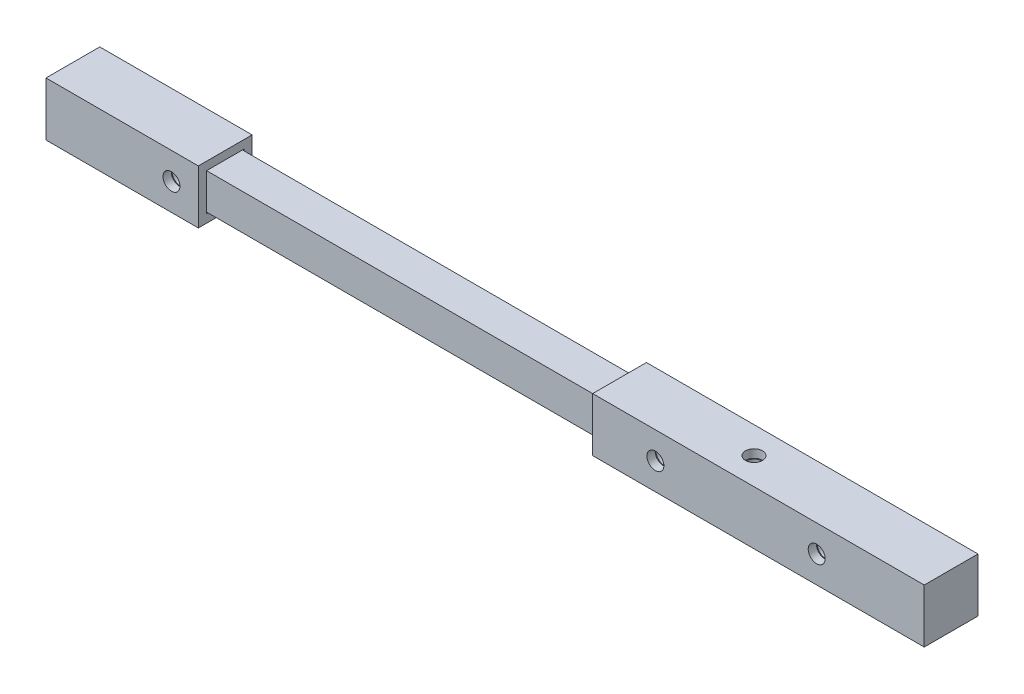
from build123d import *

# Parameters (mm, degrees)
SKETCH1_W               = 6.35
SKETCH1_H               = 6.35
BOSS_EXTRUDE1_DEPTH     = 152.4
SKETCH2_R               = 1.5
CUT_EXTRUDE1_DEPTH      = 153.565274965
SKETCH3_R               = 1.5
CUT_EXTRUDE2_DEPTH      = 153.565274965
SKETCH4_W               = 9.525
SKETCH4_H               = 9.525
SKETCH4_W_2             = 6.604
SKETCH4_H_2             = 6.604
BOSS_EXTRUDE2_DEPTH     = 57.15
SKETCH5_W               = 9.525
SKETCH5_H               = 9.525
BOSS_EXTRUDE3_DEPTH     = 1.5875
CUT_EXTRUDE4_DEPTH      = 155.26547076
CUT_EXTRUDE4_DEPTH_BACK = 155.26547076
SKETCH6_R               = 1.5
CUT_EXTRUDE6_DEPTH      = 155.26547076
CUT_EXTRUDE6_DEPTH_BACK = 155.26547076
SKETCH7_R               = 1.5
SKETCH8_W               = 9.525
SKETCH8_H               = 9.525
SKETCH8_W_2             = 6.604
SKETCH8_H_2             = 6.604
BOSS_EXTRUDE4_DEPTH     = 25.4
SKETCH9_W               = 9.525
SKETCH9_H               = 9.525
BOSS_EXTRUDE5_DEPTH     = 1.5875
CUT_EXTRUDE8_DEPTH      = 155.26547076
CUT_EXTRUDE8_DEPTH_BACK = 155.26547076
SKETCH10_R              = 1.5


with BuildPart() as part:
    # Sketch1 → Boss-Extrude1 (new body)
    with BuildSketch(Plane(origin=(0, 0, 0), x_dir=(0, 0, -1), z_dir=(1, 0, 0))):
        Rectangle(SKETCH1_W, SKETCH1_H)
    extrude(amount=BOSS_EXTRUDE1_DEPTH)

    # Sketch2 → Cut-Extrude1 (cut, through all)
    with BuildSketch(Plane.XY.offset(3.175)):
        with Locations((20.6375, 0)):
            Circle(SKETCH2_R)
        with Locations((134.9375, 0)):
            Circle(SKETCH2_R)
        with Locations((106.3625, 0)):
            Circle(SKETCH2_R)
    extrude(amount=-CUT_EXTRUDE1_DEPTH, mode=Mode.SUBTRACT)

    # Sketch3 → Cut-Extrude2 (cut, through all)
    with BuildSketch(Plane(origin=(0, 3.175, 0), x_dir=(1, 0, 0), z_dir=(0, 1, 0))):
        with Locations(Location((119.0625, 0, 0), (0, 0, 270))):
            Circle(SKETCH3_R)
    extrude(amount=-CUT_EXTRUDE2_DEPTH, mode=Mode.SUBTRACT)


with BuildPart() as body_2:
    # Sketch4 → Boss-Extrude2 (new body)
    with BuildSketch(Plane(origin=(152.4, 0, 0), x_dir=(0, 0, -1), z_dir=(1, 0, 0))):
        Rectangle(SKETCH4_W, SKETCH4_H)
        Rectangle(SKETCH4_W_2, SKETCH4_H_2, mode=Mode.SUBTRACT)
    extrude(amount=-BOSS_EXTRUDE2_DEPTH)

    # Sketch5 → Boss-Extrude3 (add)
    with BuildSketch(Plane(origin=(152.4, 0, 0), x_dir=(0, 0, -1), z_dir=(1, 0, 0))):
        Rectangle(SKETCH5_W, SKETCH5_H)
    extrude(amount=BOSS_EXTRUDE3_DEPTH)

    # Sketch6 → Cut-Extrude4 (cut, two sides: drawn at the far end of the back side and taken through both)
    with BuildSketch(Plane.XY.offset(3.175).offset(-CUT_EXTRUDE4_DEPTH_BACK)):
        with Locations((134.9375, 0)):
            Circle(SKETCH6_R)
        with Locations((106.3625, 0)):
            Circle(SKETCH6_R)
    extrude(amount=CUT_EXTRUDE4_DEPTH + CUT_EXTRUDE4_DEPTH_BACK, mode=Mode.SUBTRACT)

    # Sketch7 → Cut-Extrude6 (cut, two sides: drawn at the far end of the back side and taken through both)
    with BuildSketch(Plane(origin=(0, 3.175, 0), x_dir=(1, 0, 0), z_dir=(0, 1, 0)).offset(-CUT_EXTRUDE6_DEPTH_BACK)):
        with Locations(Location((119.0625, 0, 0), (0, 0, 270))):
            Circle(SKETCH7_R)
    extrude(amount=CUT_EXTRUDE6_DEPTH + CUT_EXTRUDE6_DEPTH_BACK, mode=Mode.SUBTRACT)


with BuildPart() as body_3:
    # Sketch8 → Boss-Extrude4 (new body)
    with BuildSketch(Plane.ZY):
        Rectangle(SKETCH8_W, SKETCH8_H)
        Rectangle(SKETCH8_W_2, SKETCH8_H_2, mode=Mode.SUBTRACT)
    extrude(amount=-BOSS_EXTRUDE4_DEPTH)

    # Sketch9 → Boss-Extrude5 (add)
    with BuildSketch(Plane.ZY):
        Rectangle(SKETCH9_W, SKETCH9_H)
    extrude(amount=BOSS_EXTRUDE5_DEPTH)

    # Sketch10 → Cut-Extrude8 (cut, two sides: drawn at the far end of the back side and taken through both)
    with BuildSketch(Plane.XY.offset(3.175).offset(-CUT_EXTRUDE8_DEPTH_BACK)):
        with Locations((20.6375, 0)):
            Circle(SKETCH10_R)
    extrude(amount=CUT_EXTRUDE8_DEPTH + CUT_EXTRUDE8_DEPTH_BACK, mode=Mode.SUBTRACT)


solid = Compound([part.part, body_2.part, body_3.part])
